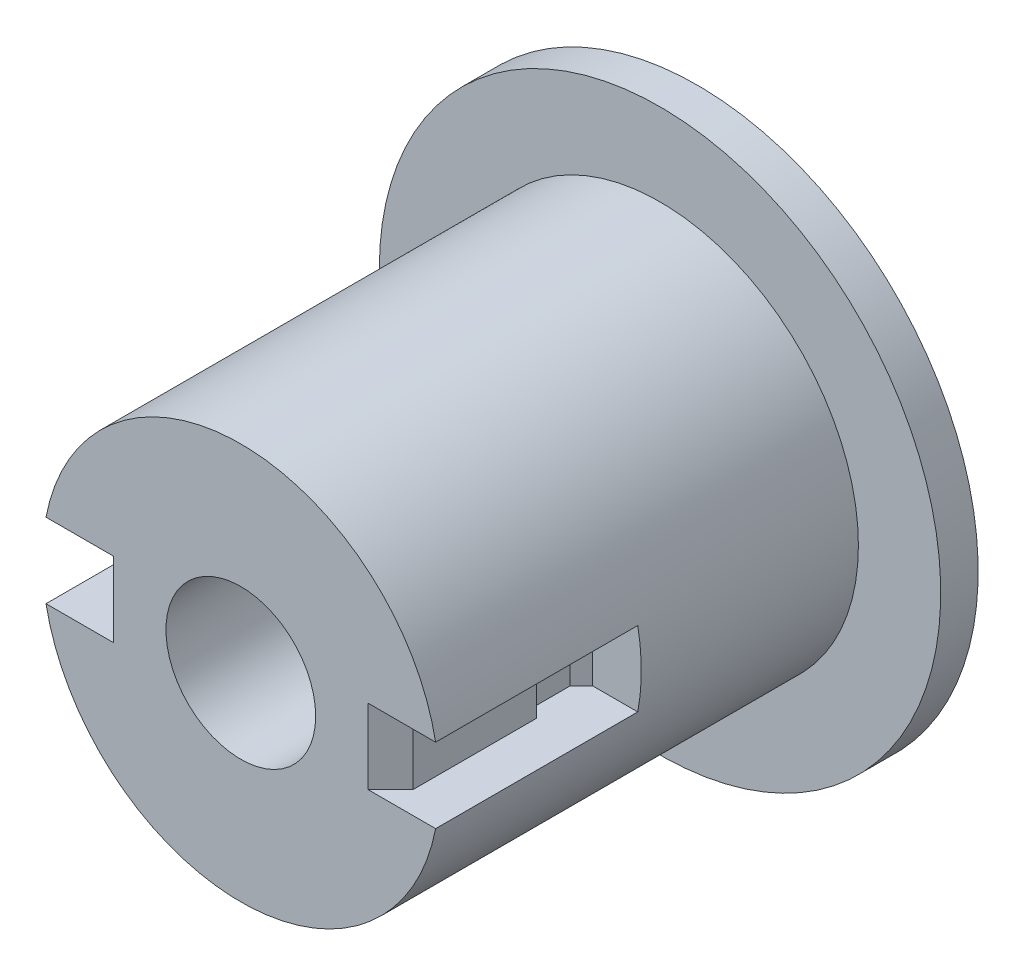
from build123d import *

# Parameters (mm, degrees)
SKETCH1_R           = 26.5
BOSS_EXTRUDE1_DEPTH = 56
SKETCH4_R           = 37.5
BOSS_EXTRUDE2_DEPTH = 5
SKETCH5_R           = 10
CUT_EXTRUDE1_DEPTH  = 81.830068663
CUT_EXTRUDE2_DEPTH  = 5


with BuildPart() as part:
    # Sketch1 → Boss-Extrude1 (new body)
    with BuildSketch(Plane.XY):
        Circle(SKETCH1_R)
    extrude(amount=BOSS_EXTRUDE1_DEPTH)

    # Sketch4 → Boss-Extrude2 (add)
    with BuildSketch(Plane(origin=(0, 0, 0), x_dir=(-1, 0, 0), z_dir=(0, 0, -1))):
        Circle(SKETCH4_R)
    extrude(amount=BOSS_EXTRUDE2_DEPTH)

    # Sketch5 → Cut-Extrude1 (cut, through all)
    with BuildSketch(Plane.XY.offset(56)):
        Circle(SKETCH5_R)
    extrude(amount=-CUT_EXTRUDE1_DEPTH, mode=Mode.SUBTRACT)

    # Sketch6 → Cut-Extrude2 (cut, symmetric)
    with BuildSketch(Plane(origin=(0, 0, 0), x_dir=(1, 0, 0), z_dir=(0, 1, 0))):
        Polygon((17, -56), (20, -56), (26.5, -56), (26.5, -29), (20, -29), (18.5, -30.5), (18.5, -35), (20, -36.5), (20, -53), align=None)
    cut_extrude2 = extrude(amount=CUT_EXTRUDE2_DEPTH, both=True, mode=Mode.SUBTRACT)

    # Mirror1: Cut-Extrude2 across plane
    add(cut_extrude2.mirror(Plane(origin=(0, 0, 0), x_dir=(0, 0, 1), z_dir=(1, 0, 0))), mode=Mode.SUBTRACT)


solid = part.part
